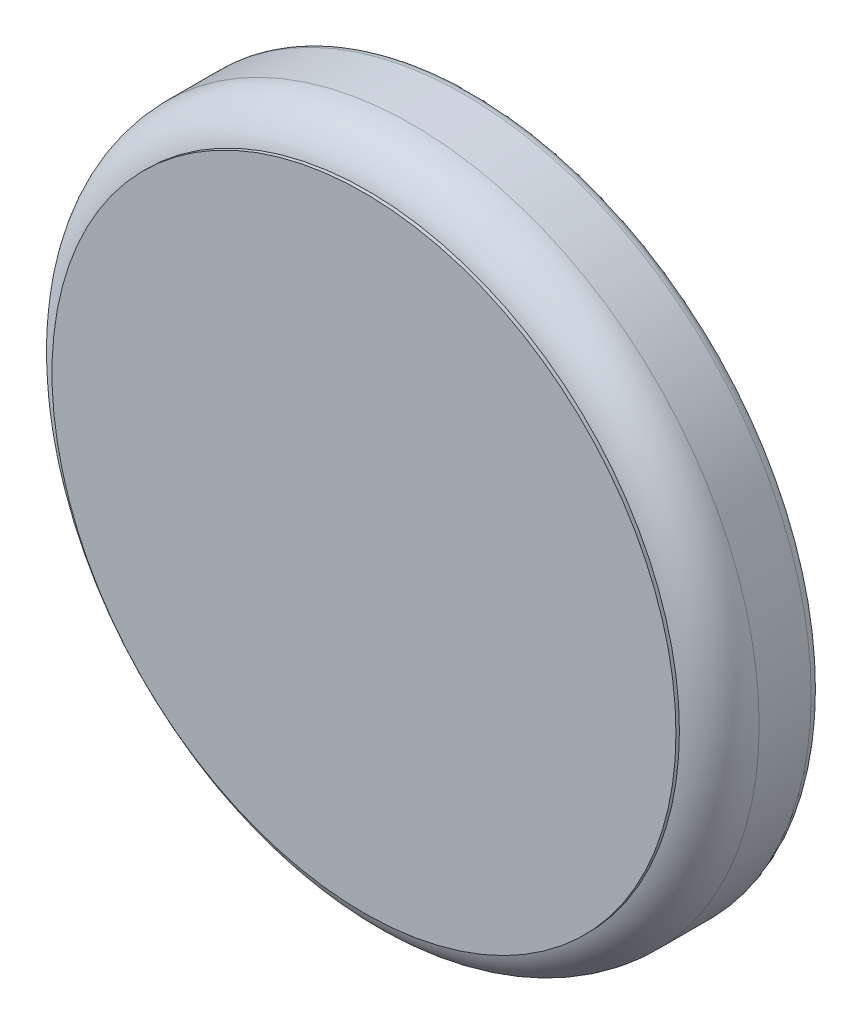
from build123d import *


with BuildPart() as part:
    # Sketch1 → Revolve1 (revolve)
    with BuildSketch(Plane(origin=(0, 0, 0), x_dir=(1, 0, 0), z_dir=(0, 1, 0))):
        with BuildLine():
            Line((0, 0), (0, 3.2))
            Line((0, 3.2), (9.7, 3.2))
            ThreePointArc((9.7, 3.2), (9.912132034, 3.112132034), (10, 2.9))
            Line((10, 2.9), (10, 1.4))
            ThreePointArc((10, 1.4), (9.721079265, 0.579939027), (9, 0.1))
            Line((9, 0.1), (9, 0))
            Line((9, 0), (0, 0))
        make_face()
    revolve(axis=Axis((0, 0, 0), (0, 0, -1)))


solid = part.part
